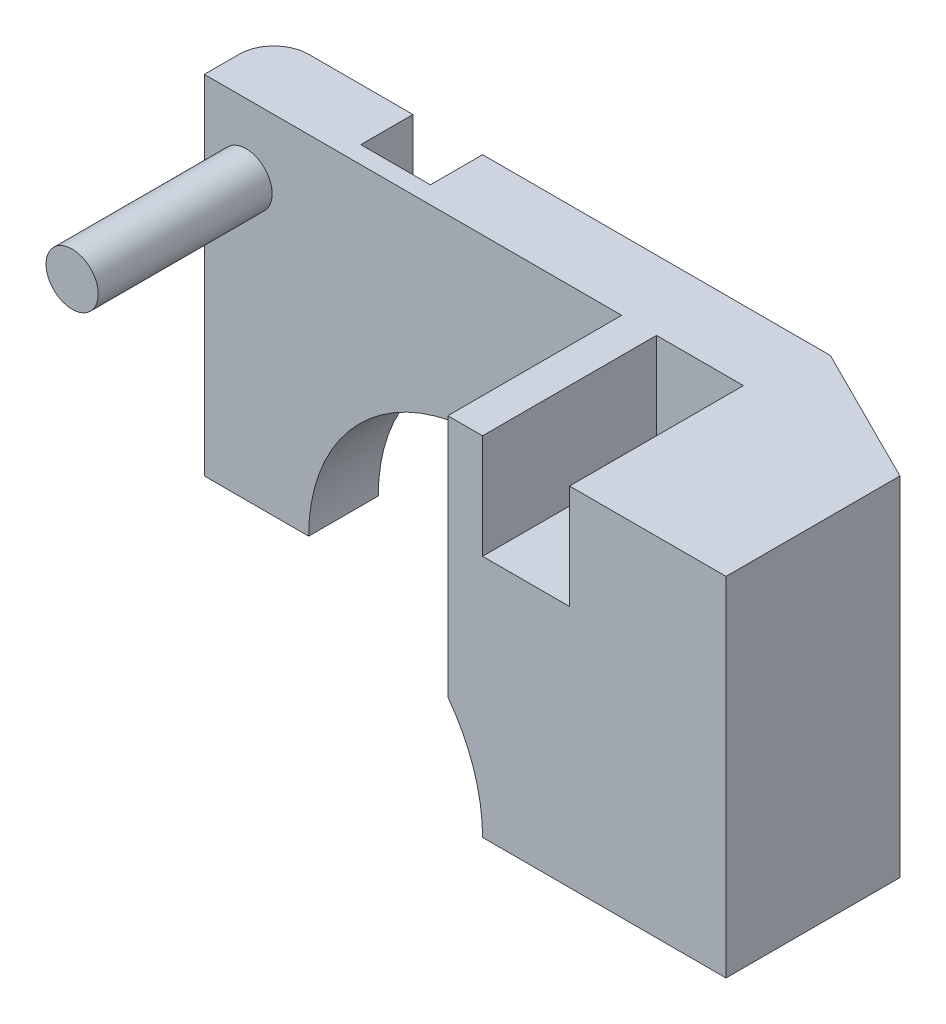
from build123d import *

# Parameters (mm, degrees)
SKICA1_W                 = 200
SKICA1_H                 = 100
P_IDAT_VYSUNUT_M1_DEPTH  = 20
P_IDAT_VYSUNUT_M2_DEPTH  = 50
ODEBRAT_VYSUNUT_M1_REACH = 236.307
SKICA4_R                 = 50
SKICA7_R                 = 7.5
P_IDAT_VYSUNUT_M3_DEPTH  = 50
ODEBRAT_VYSUNUT_M3_DEPTH = 10
ZAOBLIT1_R               = 10
ZKOSEN_1_SIZE            = 40
ZKOSEN_1_SIZE2           = 20
SKICA9_W                 = 40
SKICA9_H                 = 25
ODEBRAT_VYSUNUT_M4_DEPTH = 5


with BuildPart() as part:
    # Skica1 → Přidat vysunutím1 (new body)
    with BuildSketch(Plane.XY):
        with Locations((100, 50)):
            Rectangle(SKICA1_W, SKICA1_H)
    extrude(amount=P_IDAT_VYSUNUT_M1_DEPTH)

    # Skica2 → Přidat vysunutím2 (add)
    with BuildSketch(Plane.XY.offset(20)):
        Polygon((120, 0), (200, 0), (200, 100), (155, 100), (155, 70), (130, 70), (130, 100), (120, 100), align=None)
    extrude(amount=P_IDAT_VYSUNUT_M2_DEPTH)

    # Odebrat vysunutím1: up to this face of the body (flat: up to its plane)
    odebrat_vysunut_m1_end = Plane(part.part.faces().sort_by_distance((161.810344828, 46.379310345, 70))[0])
    # Skica4 → Odebrat vysunutím1 (cut, up to the picked face)
    with BuildSketch(Plane(origin=(0, 0, 0), x_dir=(-1, 0, 0), z_dir=(0, 0, -1)), mode=Mode.PRIVATE) as odebrat_vysunut_m1_sk1:
        with Locations((-80, 0)):
            Circle(SKICA4_R)
    odebrat_vysunut_m1_tool1 = split(extrude(odebrat_vysunut_m1_sk1.sketch, amount=-ODEBRAT_VYSUNUT_M1_REACH, mode=Mode.PRIVATE), bisect_by=odebrat_vysunut_m1_end, keep=Keep.BOTH, mode=Mode.PRIVATE)
    add(odebrat_vysunut_m1_tool1.solids().sort_by(Axis((80, 0, 0), (0, 0, 1)))[0], mode=Mode.SUBTRACT)

    # Skica7 → Přidat vysunutím3 (add)
    with BuildSketch(Plane.XY.offset(20)):
        with Locations(Location((12, 80, 0), (0, 0, 180))):
            Circle(SKICA7_R)
    extrude(amount=P_IDAT_VYSUNUT_M3_DEPTH)

    # Skica8 → Odebrat vysunutím3 (cut, symmetric)
    with BuildSketch(Plane.ZY.offset(-50)):
        Polygon((0, 100), (0, 70), (15, 100), align=None)
    extrude(amount=ODEBRAT_VYSUNUT_M3_DEPTH, both=True, mode=Mode.SUBTRACT)

    # Zaoblit1
    zaoblit1_edges = [part.edges().sort_by_distance(p)[0] for p in [
        (0, 50, 0),
    ]]
    fillet(zaoblit1_edges, radius=ZAOBLIT1_R)

    # Zkosení1
    zkosen_1_edges = [part.edges().sort_by_distance(p)[0] for p in [
        (200, 50, 0),
    ]]
    zkosen_1_side = [part.faces().sort_by_distance(p)[0] for p in [
        (114.06340684, 56.357779944, 0),
    ]]
    chamfer(zkosen_1_edges, length=ZKOSEN_1_SIZE, length2=ZKOSEN_1_SIZE2, reference=zkosen_1_side[0])

    # Skica9 → Odebrat vysunutím4 (cut)
    with BuildSketch(Plane(origin=(0, 0, 0), x_dir=(-1, 0, 0), z_dir=(0, 0, -1))):
        with Locations((-90, 77.5)):
            Rectangle(SKICA9_W, SKICA9_H)
    extrude(amount=-ODEBRAT_VYSUNUT_M4_DEPTH, mode=Mode.SUBTRACT)


solid = part.part
